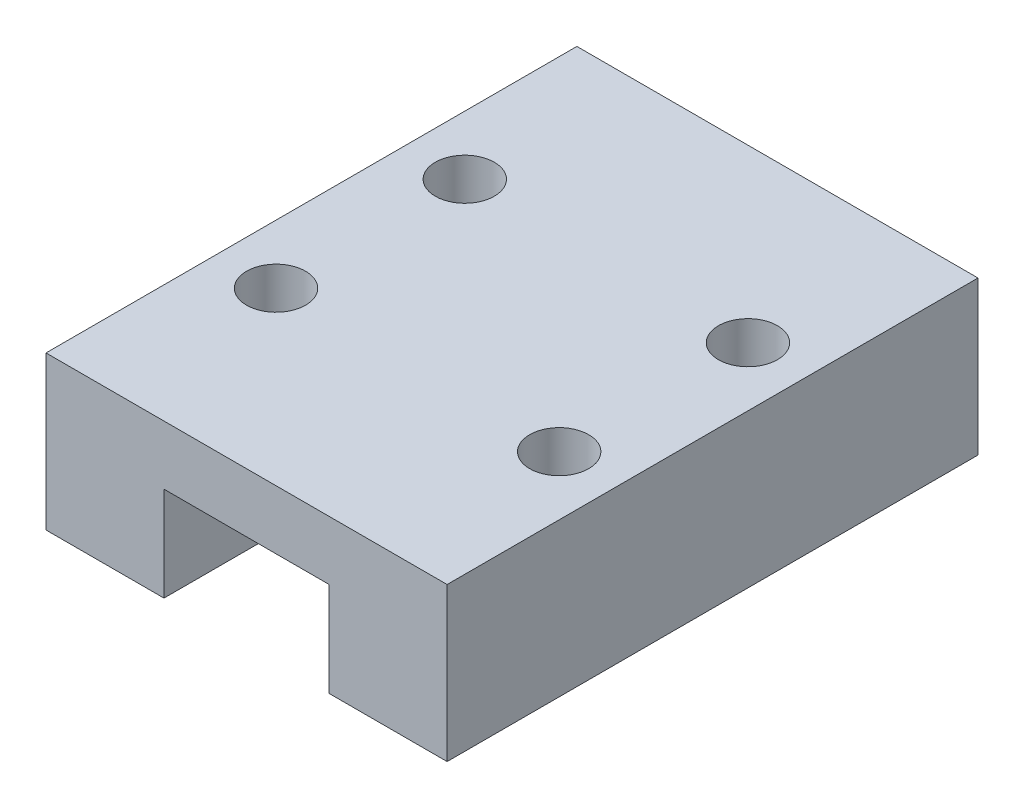
from build123d import *

# Parameters (mm, degrees)
BOSS_EXTRUDE1_DEPTH = 22.5
SKETCH2_R           = 1.25
CUT_EXTRUDE1_DEPTH  = 3


with BuildPart() as part:
    # Sketch1 → Boss-Extrude1 (new body)
    with BuildSketch(Plane.XY):
        Polygon((12, 0), (17, 0), (17, 6.5), (0, 6.5), (0, 0), (5, 0), (5, 4), (12, 4), align=None)
    extrude(amount=BOSS_EXTRUDE1_DEPTH)

    # Sketch2 → Cut-Extrude1 (cut)
    with BuildSketch(Plane(origin=(0, 6.5, 0), x_dir=(1, 0, 0), z_dir=(0, 1, 0))):
        with Locations(Location((14.5, -7.25, 0), (0, 0, 270))):
            Circle(SKETCH2_R)
        with Locations(Location((2.5, -7.25, 0), (0, 0, 270))):
            Circle(SKETCH2_R)
        with Locations(Location((2.5, -15.25, 0), (0, 0, 270))):
            Circle(SKETCH2_R)
        with Locations(Location((14.5, -15.25, 0), (0, 0, 270))):
            Circle(SKETCH2_R)
    extrude(amount=-CUT_EXTRUDE1_DEPTH, mode=Mode.SUBTRACT)


solid = part.part
